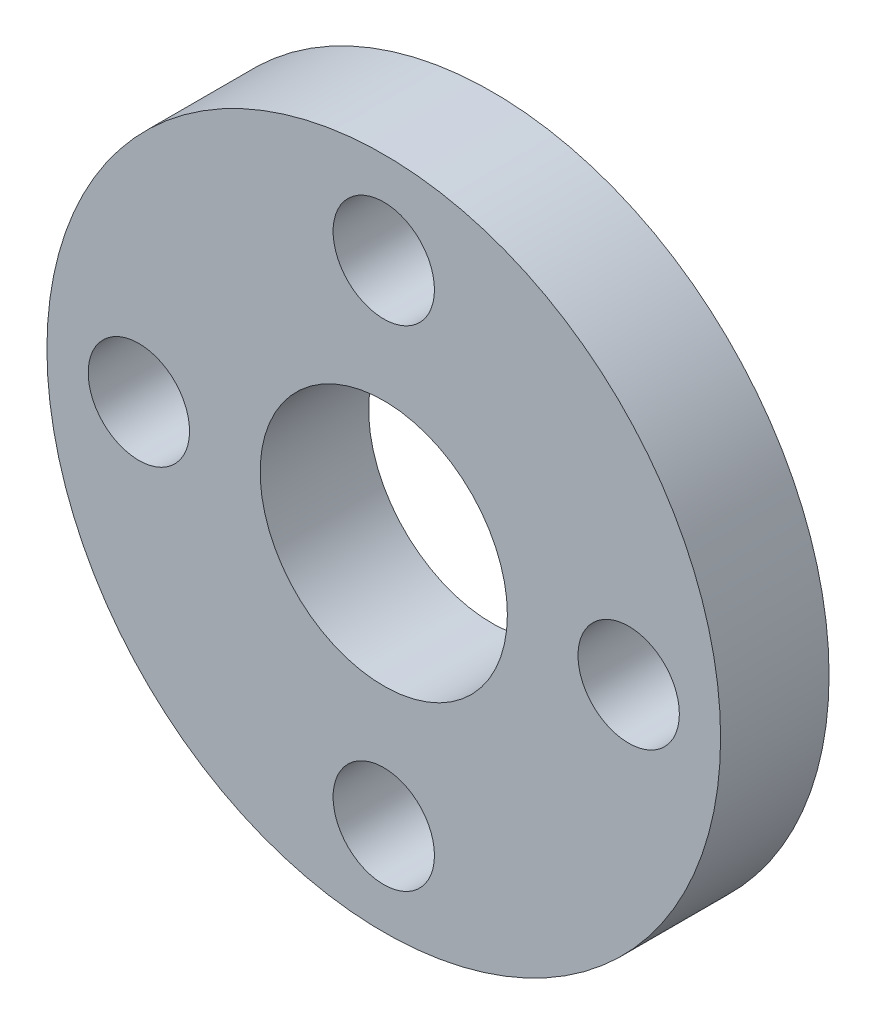
from build123d import *

# Parameters (mm, degrees)
SKETCH_1_R          = 10.9
EXTRUDE_1_DEPTH     = 3.51
SKETCH_2_R          = 1.64
CUT_EXTRUDE_1_DEPTH = 3.51
SKETCH_3_R          = 4
CUT_EXTRUDE_2_DEPTH = 10


with BuildPart() as part:
    # 草图1 → 凸台-拉伸1 (new body)
    with BuildSketch(Plane.XY):
        Circle(SKETCH_1_R)
    extrude(amount=EXTRUDE_1_DEPTH)

    # 草图2 → 切除-拉伸1 (cut)
    with BuildSketch(Plane.XY.offset(3.51)):
        with Locations((7.925, 0)):
            Circle(SKETCH_2_R)
        with Locations((-7.925, 0)):
            Circle(SKETCH_2_R)
        with Locations((0, 7.925)):
            Circle(SKETCH_2_R)
        with Locations((0, -7.925)):
            Circle(SKETCH_2_R)
    extrude(amount=-CUT_EXTRUDE_1_DEPTH, mode=Mode.SUBTRACT)

    # 草图3 → 切除-拉伸2 (cut)
    with BuildSketch(Plane.XY.offset(3.51)):
        Circle(SKETCH_3_R)
    extrude(amount=-CUT_EXTRUDE_2_DEPTH, mode=Mode.SUBTRACT)


solid = part.part
